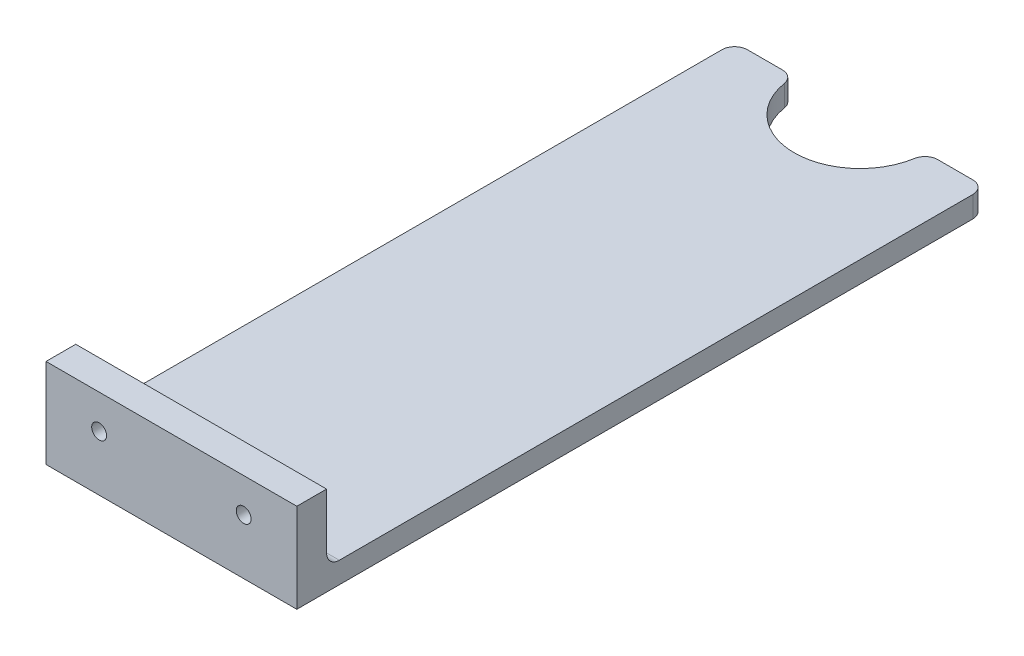
from build123d import *

# Parameters (mm, degrees)
SKETCH1_W           = 59
SKETCH1_H           = 21
SKETCH1_R           = 1.75
BOSS_EXTRUDE1_DEPTH = 7
SKETCH2_W           = 59
SKETCH2_H           = 5
BOSS_EXTRUDE2_DEPTH = 155
CUT_EXTRUDE1_DEPTH  = 159.591456264
FILLET1_R           = 3
FILLET2_R           = 3


with BuildPart() as part:
    # Sketch1 → Boss-Extrude1 (new body)
    with BuildSketch(Plane.XY):
        with Locations((0, -2.5)):
            Rectangle(SKETCH1_W, SKETCH1_H)
        with Locations((-17, 0)):
            Circle(SKETCH1_R, mode=Mode.SUBTRACT)
        with Locations((17, 0)):
            Circle(SKETCH1_R, mode=Mode.SUBTRACT)
    extrude(amount=BOSS_EXTRUDE1_DEPTH)

    # Sketch2 → Boss-Extrude2 (add)
    with BuildSketch(Plane(origin=(0, 0, 0), x_dir=(-1, 0, 0), z_dir=(0, 0, -1))):
        with Locations((0, -10.5)):
            Rectangle(SKETCH2_W, SKETCH2_H)
    extrude(amount=BOSS_EXTRUDE2_DEPTH)

    # Sketch4 → Cut-Extrude1 (cut, through all)
    with BuildSketch(Plane(origin=(0, -8, 0), x_dir=(1, 0, 0), z_dir=(0, 1, 0))):
        with BuildLine():
            Line((-15.5, 155), (15.5, 155))
            ThreePointArc((15.5, 155), (0, 139.5), (-15.5, 155))
        make_face()
    extrude(amount=-CUT_EXTRUDE1_DEPTH, mode=Mode.SUBTRACT)

    # Fillet1
    fillet1_edges = [part.edges().sort_by_distance(p)[0] for p in [
        (0, -8, 0),
    ]]
    fillet(fillet1_edges, radius=FILLET1_R)

    # Fillet2
    fillet2_edges = [part.edges().sort_by_distance(p)[0] for p in [
        (29.5, -10.5, -155),
        (-29.5, -10.5, -155),
        (15.5, -10.5, -155),
        (-15.5, -10.5, -155),
    ]]
    fillet(fillet2_edges, radius=FILLET2_R)


solid = part.part
